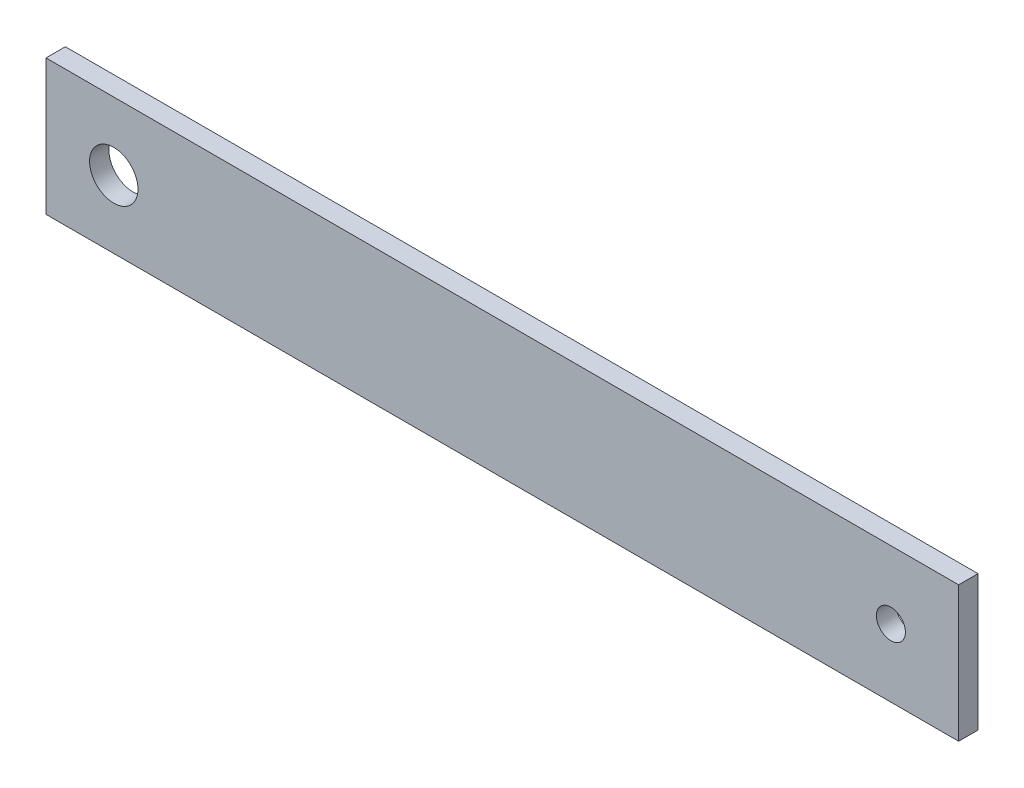
from build123d import *

# Parameters (mm, degrees)
SKETCH_1_W      = 188.6
SKETCH_1_H      = 28
SKETCH_1_R      = 5
SKETCH_1_R_2    = 3
EXTRUDE_1_DEPTH = 2


with BuildPart() as part:
    # 草图1 → 凸台-拉伸1 (new, symmetric)
    with BuildSketch(Plane.XY):
        with Locations((80.3, 0)):
            Rectangle(SKETCH_1_W, SKETCH_1_H)
        Circle(SKETCH_1_R, mode=Mode.SUBTRACT)
        with Locations((160.6, 0)):
            Circle(SKETCH_1_R_2, mode=Mode.SUBTRACT)
    extrude(amount=EXTRUDE_1_DEPTH, both=True)


solid = part.part
